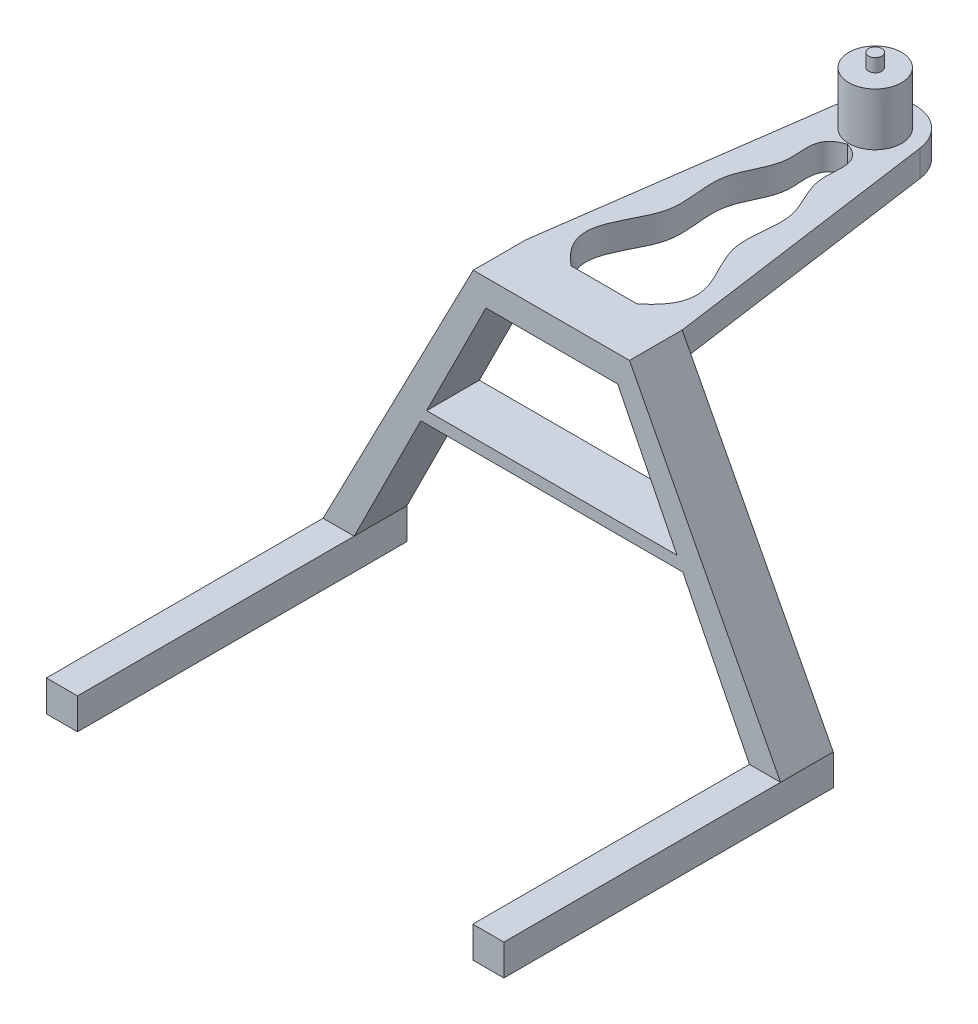
from build123d import *

# Parameters (mm, degrees)
SKETCH1_W             = 59.9694
SKETCH1_H             = 59.9694
BOSS_EXTRUDE1_DEPTH   = 635
BOSS_EXTRUDE1_2_DEPTH = 635
BOSS_EXTRUDE2_DEPTH   = 101.6
BOSS_EXTRUDE3_DEPTH   = 101.6
BOSS_EXTRUDE4_DEPTH   = 50.8
CUT_EXTRUDE1_DEPTH    = 1210.022028299
SKETCH10_R            = 50.8
BOSS_EXTRUDE5_DEPTH   = 101.6
SKETCH11_R            = 12.7
BOSS_EXTRUDE6_DEPTH   = 25.4


with BuildPart() as part:
    # Sketch1 → Boss-Extrude1 (new body)
    with BuildSketch(Plane.XY):
        with Locations((791.9847, 29.9847)):
            Rectangle(SKETCH1_W, SKETCH1_H)
    extrude(amount=BOSS_EXTRUDE1_DEPTH)



with BuildPart() as body_2:
    # Sketch1 → Boss-Extrude1 2 (new body)
    with BuildSketch(Plane.XY):
        with Locations((-29.9847, 29.9847)):
            Rectangle(SKETCH1_W, SKETCH1_H)
    extrude(amount=BOSS_EXTRUDE1_2_DEPTH)


with BuildPart() as part_1:
    add(part.part)

    add(body_2.part)  # Boss-Extrude2 merges body 2
    # Sketch5 → Boss-Extrude2 (add)
    with BuildSketch(Plane.XY):
        Polygon((254, 567.9694), (508, 567.9694), (762, 59.9694), (821.9694, 59.9694), (530.740058053, 618.7694), (229.51694, 618.7694), (-59.9694, 59.9694), (0, 59.9694), align=None)
    extrude(amount=BOSS_EXTRUDE2_DEPTH)

    # Sketch6 → Boss-Extrude3 (add)
    with BuildSketch(Plane.XY):
        Polygon((84.77377, 339.3694), (676.354729026, 339.3694), (688.093813572, 316.84488238), (73.104943647, 316.84488238), align=None)
    extrude(amount=BOSS_EXTRUDE3_DEPTH)

    # Sketch7 → Boss-Extrude4 (add)
    with BuildSketch(Plane(origin=(0, 618.7694, 0), x_dir=(1, 0, 0), z_dir=(0, 1, 0))):
        with BuildLine():
            Line((229.51694, 0), (303.928499026, 533.325167084))
            ThreePointArc((303.928499026, 533.325167084), (380.128499026, 599.631566556), (456.328499026, 533.325167084))
            Line((456.328499026, 533.325167084), (530.740058053, 0))
            Line((530.740058053, 0), (229.51694, 0))
        make_face()
    extrude(amount=-BOSS_EXTRUDE4_DEPTH)

    # Sketch9 → Cut-Extrude1 (cut, through all)
    with BuildSketch(Plane(origin=(0, 618.7694, 0), x_dir=(1, 0, 0), z_dir=(0, 1, 0))):
        with BuildLine():
            Line((316.63894, 0), (443.63894, 0))
            add(Edge.make_bspline(
                [(443.63894, 0), (534.092966377, 73.272550309), (412.87552259, 153.810052423), (462.148891497, 296.07624868), (393.499435083, 382.146243658), (427.489547729, 454.141623856), (380.13894, 469.395677589)],
                knots=[0, 0, 0, 0, 0.403522035, 0.617987336, 0.803164244, 1, 1, 1, 1], degree=3))
            add(Edge.make_bspline(
                [(316.63894, 0), (226.184913623, 73.272550309), (347.40235741, 153.810052423), (298.128988503, 296.07624868), (366.778444917, 382.146243658), (332.788332271, 454.141623856), (380.13894, 469.395677589)],
                knots=[0, 0, 0, 0, 0.403522035, 0.617987336, 0.803164244, 1, 1, 1, 1], degree=3))
        make_face()
    extrude(amount=-CUT_EXTRUDE1_DEPTH, mode=Mode.SUBTRACT)

    # Sketch10 → Boss-Extrude5 (add)
    with BuildSketch(Plane(origin=(0, 618.7694, 0), x_dir=(1, 0, 0), z_dir=(0, 1, 0))):
        with Locations(Location((380.128499026, 522.693452798, 0), (0, 0, 90))):
            Circle(SKETCH10_R)
    extrude(amount=BOSS_EXTRUDE5_DEPTH)

    # Sketch11 → Boss-Extrude6 (add)
    with BuildSketch(Plane(origin=(0, 720.3694, 0), x_dir=(1, 0, 0), z_dir=(0, 1, 0))):
        with Locations(Location((380.128499026, 522.693452798, 0), (0, 0, 270))):
            Circle(SKETCH11_R)
    extrude(amount=BOSS_EXTRUDE6_DEPTH)


solid = part_1.part
